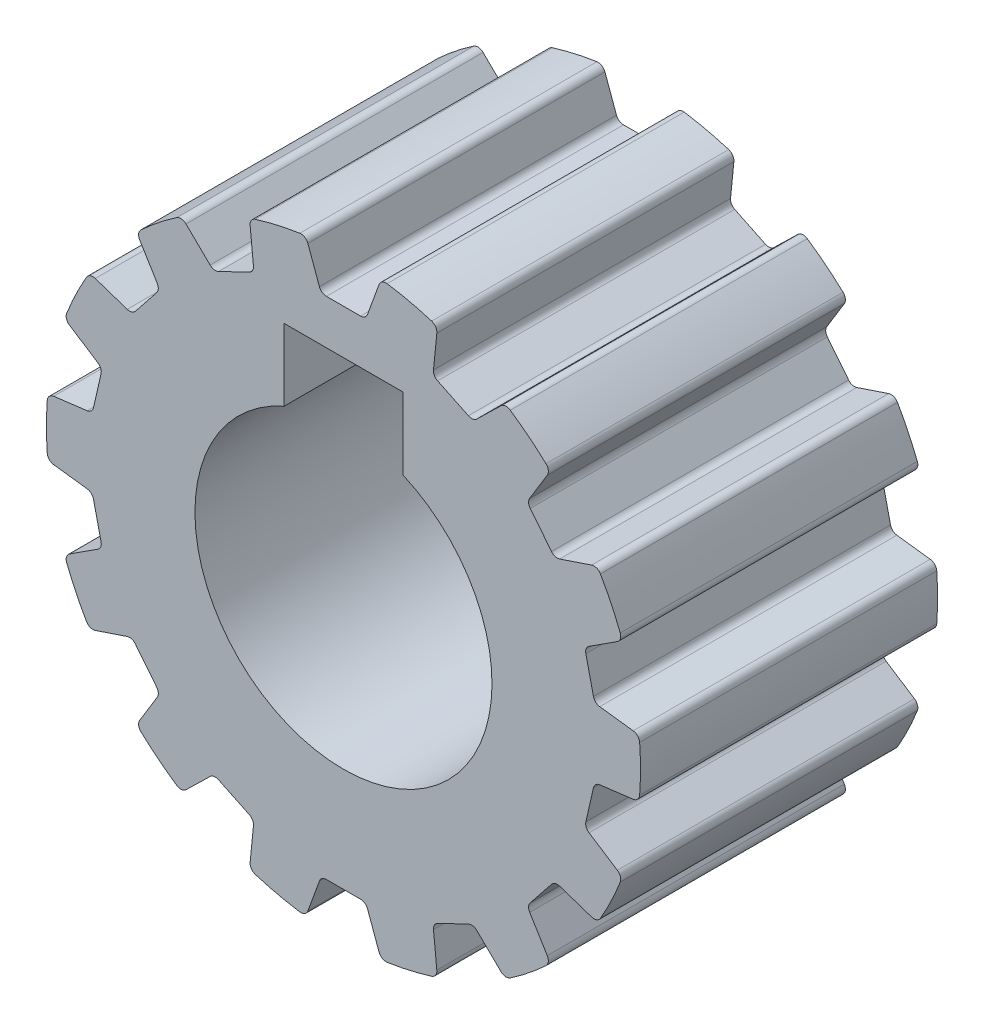
from build123d import *

# Parameters (mm, degrees)
SKETCH1_R           = 10
BOSS_EXTRUDE1_DEPTH = 10
CUT_EXTRUDE1_DEPTH  = 18.320508076
CIRPATTERN1_COUNT   = 14
FILLET1_R           = 0.25


with BuildPart() as part:
    # Sketch1 → Boss-Extrude1 (new body)
    with BuildSketch(Plane.XY):
        Circle(SKETCH1_R)
        with BuildLine():
            Line((-2, 4.582575695), (-2, 7))
            Line((-2, 7), (2, 7))
            Line((2, 7), (2, 4.582575695))
            ThreePointArc((2, 4.582575695), (0, -5), (-2, 4.582575695))
        make_face(mode=Mode.SUBTRACT)
    extrude(amount=BOSS_EXTRUDE1_DEPTH)

    # Sketch2 → Cut-Extrude1 (cut, through all)
    with BuildSketch(Plane.XY.offset(10)):
        with BuildLine():
            Line((-0.75, 8.5), (0, 8.5))
            Line((0, 8.5), (0, 10))
            ThreePointArc((0, 10), (-0.634599116, 9.979843885), (-1.266640021, 9.919456792))
            Line((-1.266640021, 9.919456792), (-0.75, 8.5))
        make_face()
        with BuildLine():
            Line((0, 10), (0, 8.5))
            Line((0, 8.5), (0.75, 8.5))
            Line((0.75, 8.5), (1.266640021, 9.919456792))
            ThreePointArc((1.266640021, 9.919456792), (0.634599116, 9.979843885), (0, 10))
        make_face()
    cut_extrude1 = extrude(amount=-CUT_EXTRUDE1_DEPTH, mode=Mode.SUBTRACT)

    # CirPattern1: Cut-Extrude1 ×14 about axis
    cirpattern1_axis = Axis((0, 0, 0), (0, 0, 1))
    for i in range(1, CIRPATTERN1_COUNT):
        add(cut_extrude1.rotate(cirpattern1_axis, i * 360 / CIRPATTERN1_COUNT), mode=Mode.SUBTRACT)

    # Fillet1
    fillet1_edges = [part.edges().sort_by_distance(p)[0] for p in [
        (7.113184952, 4.713289704, 5),
        (8.545080745, 5.194381104, 5),
        (9.38890138, 3.442169501, 5),
        (8.119996553, 2.622623873, 5),
        (8.453777954, 1.160232004, 5),
        (9.952609221, 0.972404078, 5),
        (9.952609221, -0.972404078, 5),
        (8.453777954, -1.160232004, 5),
        (8.119996553, -2.622623873, 5),
        (9.38890138, -3.442169501, 5),
        (8.545080745, -5.194381104, 5),
        (7.113184952, -4.713289704, 5),
        (6.17795025, -5.886036928, 5),
        (6.965606473, -7.174979196, 5),
        (5.445094229, -8.387547248, 5),
        (4.363738433, -7.332822573, 5),
        (3.012285132, -7.983648182, 5),
        (3.162687777, -9.486696265, 5),
        (1.266640021, -9.919456792, 5),
        (0.75, -8.5, 5),
        (-0.75, -8.5, 5),
        (-1.266640021, -9.919456792, 5),
        (-3.162687777, -9.486696265, 5),
        (-3.012285132, -7.983648182, 5),
        (-4.363738433, -7.332822573, 5),
        (-5.445094229, -8.387547248, 5),
        (-6.965606473, -7.174979196, 5),
        (-6.17795025, -5.886036928, 5),
        (-7.113184952, -4.713289704, 5),
        (-8.545080745, -5.194381104, 5),
        (-9.38890138, -3.442169501, 5),
        (-8.119996553, -2.622623873, 5),
        (-8.453777954, -1.160232004, 5),
        (-9.952609221, -0.972404078, 5),
        (-9.952609221, 0.972404078, 5),
        (-8.453777954, 1.160232004, 5),
        (-8.119996553, 2.622623873, 5),
        (-9.38890138, 3.442169501, 5),
        (-8.545080745, 5.194381104, 5),
        (-7.113184952, 4.713289704, 5),
        (-6.17795025, 5.886036928, 5),
        (-6.965606473, 7.174979196, 5),
        (-5.445094229, 8.387547248, 5),
        (-4.363738433, 7.332822573, 5),
        (-3.012285132, 7.983648182, 5),
        (-3.162687777, 9.486696265, 5),
        (3.162687777, 9.486696265, 5),
        (3.012285132, 7.983648182, 5),
        (4.363738433, 7.332822573, 5),
        (5.445094229, 8.387547248, 5),
        (0.75, 8.5, 5),
        (-0.75, 8.5, 5),
        (-1.266640021, 9.919456792, 5),
        (1.266640021, 9.919456792, 5),
        (6.965606473, 7.174979196, 5),
        (6.17795025, 5.886036928, 5),
    ]]
    fillet(fillet1_edges, radius=FILLET1_R)


solid = part.part
